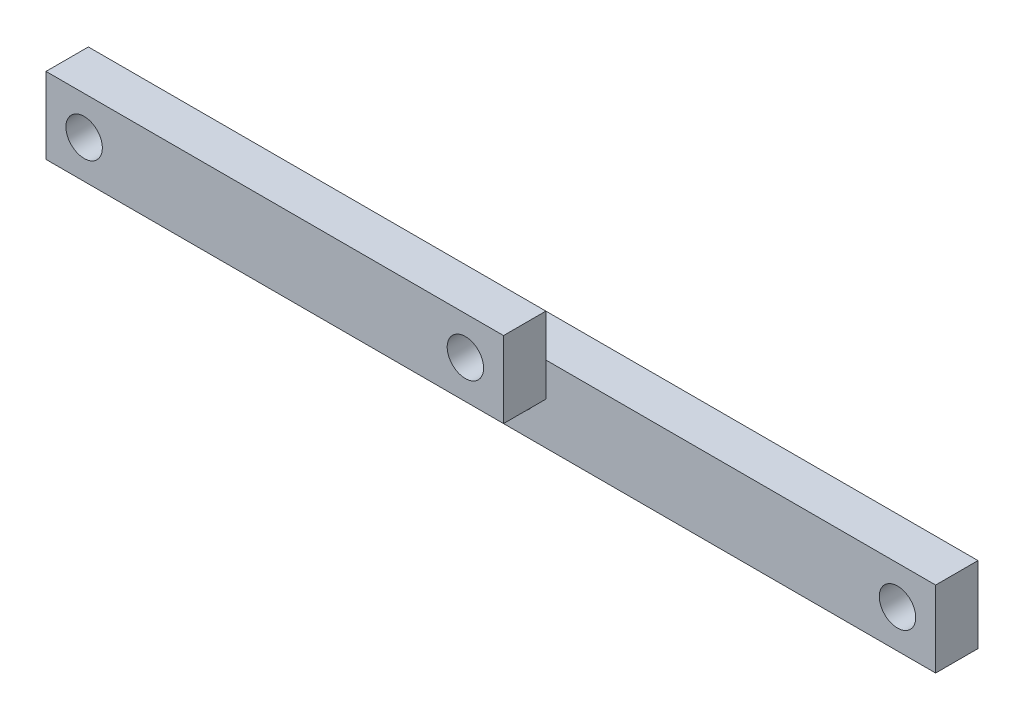
from build123d import *

# Parameters (mm, degrees)
SKETCH1_W               = 54
SKETCH1_H               = 9
BOSS_EXTRUDE3_DEPTH     = 5
SKETCH2_W               = 54
SKETCH2_H               = 9
BOSS_EXTRUDE4_DEPTH     = 5
CUT_EXTRUDE1_DEPTH      = 84.338166527
CUT_EXTRUDE1_DEPTH_BACK = 84.338166527
SKETCH3_R               = 2.15


with BuildPart() as part:
    # Sketch1 → Boss-Extrude3 (new body)
    with BuildSketch(Plane.XY):
        Rectangle(SKETCH1_W, SKETCH1_H)
    extrude(amount=BOSS_EXTRUDE3_DEPTH)


with BuildPart() as body_2:
    # Sketch2 → Boss-Extrude4 (new body)
    with BuildSketch(Plane(origin=(0, 0, -51), x_dir=(-1, 0, 0), z_dir=(0, 0, -1))):
        with Locations((0, -51)):
            Rectangle(SKETCH2_W, SKETCH2_H)
    extrude(amount=-BOSS_EXTRUDE4_DEPTH)


with BuildPart() as cut_extrude1_tool:
    # Sketch3 → Cut-Extrude1 (new, two sides: drawn at the far end of the back side and taken through both)
    with BuildSketch(Plane.XY.offset(5).offset(-CUT_EXTRUDE1_DEPTH_BACK)):
        with Locations((22.5, 0)):
            Circle(SKETCH3_R)
        with Locations((-22.5, 0)):
            Circle(SKETCH3_R)
        with Locations((-22.5, -51)):
            Circle(SKETCH3_R)
        with Locations((22.5, -51)):
            Circle(SKETCH3_R)
    extrude(amount=CUT_EXTRUDE1_DEPTH + CUT_EXTRUDE1_DEPTH_BACK)


with BuildPart() as part_1:
    add(part.part)

    # Cut-Extrude1: cut by cut_extrude1_tool
    add(cut_extrude1_tool.part, mode=Mode.SUBTRACT)


with BuildPart() as body_2_1:
    add(body_2.part)

    # Cut-Extrude1: cut by cut_extrude1_tool
    add(cut_extrude1_tool.part, mode=Mode.SUBTRACT)


solid = Compound([part_1.part, body_2_1.part])
